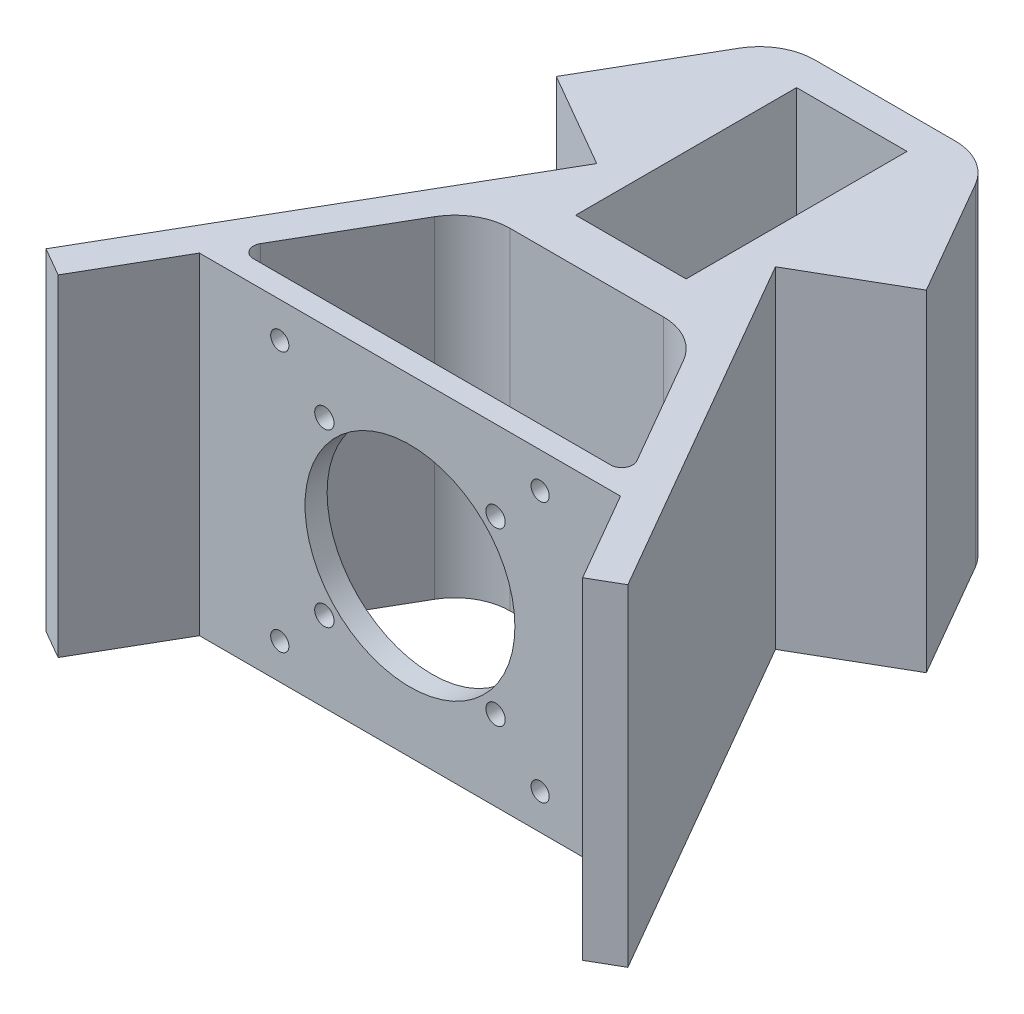
from build123d import *

# Parameters (mm, degrees)
SKETCH_1_W        = 20
SKETCH_1_H        = 40
EXTRUDE_821_DEPTH = 30
FILLET_1_R        = 10
FILLET_2_R        = 2
NEMA17_REACH      = 107.219
SKETCH_2_R        = 19
SKETCH_2_R_2      = 1.75
NEMA23_M4_REACH   = 107.219
NEMA23_M4_BORE_R  = 1.65


with BuildPart() as part:
    # Эскиз1 → Extrude 821 (new, symmetric)
    with BuildSketch(Plane(origin=(0, 0, 0), x_dir=(1, 0, 0), z_dir=(0, 1, 0))):
        Polygon((-38.118802154, -50), (38.118802154, -50), (47.483339502, -66.219854476), (52.679491924, -63.219854476), (16.179491924, 0), (33.5, 10), (18.488893001, 36), (-18.488893001, 36), (-33.5, 10), (-16.179491924, 0), (-52.679491924, -63.219854476), (-47.483339502, -66.219854476), align=None)
        Polygon((-35.809401077, -46), (-19.643593539, -18), (19.643593539, -18), (35.809401077, -46), align=None, mode=Mode.SUBTRACT)
        with Locations((0, 10)):
            Rectangle(SKETCH_1_W, SKETCH_1_H, mode=Mode.SUBTRACT)
    extrude(amount=EXTRUDE_821_DEPTH, both=True)

    # Скругление1
    fillet_1_edges = [part.edges().sort_by_distance(p)[0] for p in [
        (-18.488893001, 0, -36),
        (18.488893001, 0, -36),
        (19.643593539, 0, 18),
        (-19.643593539, 0, 18),
    ]]
    fillet(fillet_1_edges, radius=FILLET_1_R)

    # Скругление2
    fillet_2_edges = [part.edges().sort_by_distance(p)[0] for p in [
        (35.809401077, 0, 46),
        (-35.809401077, 0, 46),
    ]]
    fillet(fillet_2_edges, radius=FILLET_2_R)

    # Эскиз2 → Nema17 (cut, up to next)
    with BuildSketch(Plane.XY.offset(50), mode=Mode.PRIVATE) as nema17_sk1:
        Circle(SKETCH_2_R)
    nema17_tool1 = extrude(nema17_sk1.sketch, amount=-NEMA17_REACH, mode=Mode.PRIVATE) & part.part
    # Эскиз2 → Nema17 (cut, up to next)
    with BuildSketch(Plane.XY.offset(50), mode=Mode.PRIVATE) as nema17_sk2:
        with Locations((-15.5, 15.5)):
            Circle(SKETCH_2_R_2)
    nema17_tool2 = extrude(nema17_sk2.sketch, amount=-NEMA17_REACH, mode=Mode.PRIVATE) & part.part
    # Эскиз2 → Nema17 (cut, up to next)
    with BuildSketch(Plane.XY.offset(50), mode=Mode.PRIVATE) as nema17_sk3:
        with Locations((15.5, 15.5)):
            Circle(SKETCH_2_R_2)
    nema17_tool3 = extrude(nema17_sk3.sketch, amount=-NEMA17_REACH, mode=Mode.PRIVATE) & part.part
    # Эскиз2 → Nema17 (cut, up to next)
    with BuildSketch(Plane.XY.offset(50), mode=Mode.PRIVATE) as nema17_sk4:
        with Locations((15.5, -15.5)):
            Circle(SKETCH_2_R_2)
    nema17_tool4 = extrude(nema17_sk4.sketch, amount=-NEMA17_REACH, mode=Mode.PRIVATE) & part.part
    # Эскиз2 → Nema17 (cut, up to next)
    with BuildSketch(Plane.XY.offset(50), mode=Mode.PRIVATE) as nema17_sk5:
        with Locations((-15.5, -15.5)):
            Circle(SKETCH_2_R_2)
    nema17_tool5 = extrude(nema17_sk5.sketch, amount=-NEMA17_REACH, mode=Mode.PRIVATE) & part.part
    add(nema17_tool1.solids().sort_by_distance((0, 0, 50))[0], mode=Mode.SUBTRACT)
    add(nema17_tool2.solids().sort_by_distance((-15.5, 15.5, 50))[0], mode=Mode.SUBTRACT)
    add(nema17_tool3.solids().sort_by_distance((15.5, 15.5, 50))[0], mode=Mode.SUBTRACT)
    add(nema17_tool4.solids().sort_by_distance((15.5, -15.5, 50))[0], mode=Mode.SUBTRACT)
    add(nema17_tool5.solids().sort_by_distance((-15.5, -15.5, 50))[0], mode=Mode.SUBTRACT)

    # Nema23 - M4 bore → Nema23 - M4 (cut, up to next)
    with BuildSketch(Plane.XY.offset(50), mode=Mode.PRIVATE) as nema23_m4_sk1:
        with Locations((-23.57, 23.57)):
            Circle(NEMA23_M4_BORE_R)
    nema23_m4_tool1 = extrude(nema23_m4_sk1.sketch, amount=-NEMA23_M4_REACH, mode=Mode.PRIVATE) & part.part
    # Nema23 - M4 bore → Nema23 - M4 (cut, up to next)
    with BuildSketch(Plane.XY.offset(50), mode=Mode.PRIVATE) as nema23_m4_sk2:
        with Locations((23.57, 23.57)):
            Circle(NEMA23_M4_BORE_R)
    nema23_m4_tool2 = extrude(nema23_m4_sk2.sketch, amount=-NEMA23_M4_REACH, mode=Mode.PRIVATE) & part.part
    # Nema23 - M4 bore → Nema23 - M4 (cut, up to next)
    with BuildSketch(Plane.XY.offset(50), mode=Mode.PRIVATE) as nema23_m4_sk3:
        with Locations((23.57, -23.57)):
            Circle(NEMA23_M4_BORE_R)
    nema23_m4_tool3 = extrude(nema23_m4_sk3.sketch, amount=-NEMA23_M4_REACH, mode=Mode.PRIVATE) & part.part
    # Nema23 - M4 bore → Nema23 - M4 (cut, up to next)
    with BuildSketch(Plane.XY.offset(50), mode=Mode.PRIVATE) as nema23_m4_sk4:
        with Locations((-23.57, -23.57)):
            Circle(NEMA23_M4_BORE_R)
    nema23_m4_tool4 = extrude(nema23_m4_sk4.sketch, amount=-NEMA23_M4_REACH, mode=Mode.PRIVATE) & part.part
    add(nema23_m4_tool1.solids().sort_by_distance((-23.57, 23.57, 50))[0], mode=Mode.SUBTRACT)
    add(nema23_m4_tool2.solids().sort_by_distance((23.57, 23.57, 50))[0], mode=Mode.SUBTRACT)
    add(nema23_m4_tool3.solids().sort_by_distance((23.57, -23.57, 50))[0], mode=Mode.SUBTRACT)
    add(nema23_m4_tool4.solids().sort_by_distance((-23.57, -23.57, 50))[0], mode=Mode.SUBTRACT)


solid = part.part
